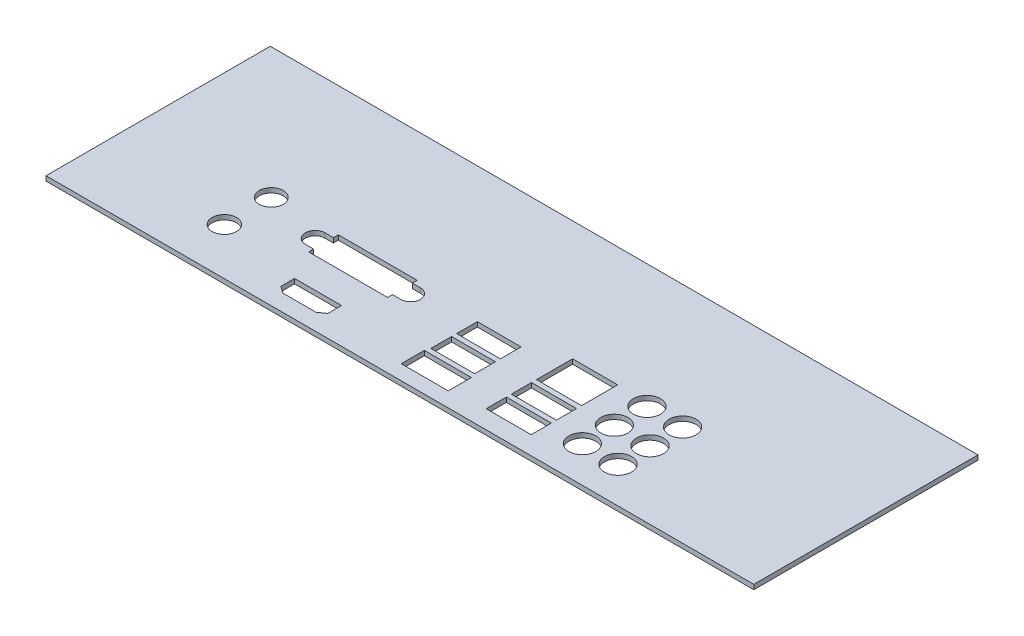
from build123d import *

# Parameters (mm, degrees)
SKETCH1_W           = 239.388843642
SKETCH1_H           = 75.842411424
BOSS_EXTRUDE1_DEPTH = 1.5875
CUT_EXTRUDE1_REACH  = 127.568
SKETCH2_R           = 4.1275
SKETCH2_R_2         = 4.572
SKETCH2_R_3         = 4.0513
SKETCH2_W           = 14.8082
SKETCH2_H           = 7.0104
SKETCH2_W_2         = 15.9004
SKETCH2_H_2         = 7.8232
SKETCH2_W_3         = 15.24
SKETCH2_H_3         = 12.2174
SKETCH2_H_4         = 6.8072


with BuildPart() as part:
    # Sketch1 → Boss-Extrude1 (new body)
    with BuildSketch(Plane(origin=(0, 0, 0), x_dir=(1, 0, 0), z_dir=(0, 1, 0))):
        Rectangle(SKETCH1_W, SKETCH1_H)
    extrude(amount=-BOSS_EXTRUDE1_DEPTH)

    # Sketch2 → Cut-Extrude1 (cut, up to next)
    with BuildSketch(Plane(origin=(0, 0, 0), x_dir=(1, 0, 0), z_dir=(0, 1, 0)), mode=Mode.PRIVATE) as cut_extrude1_sk1:
        with Locations(Location((-75.244421821, -22.046205712, 0), (0, 0, 270))):
            Circle(SKETCH2_R)
    cut_extrude1_tool1 = extrude(cut_extrude1_sk1.sketch, amount=-CUT_EXTRUDE1_REACH, mode=Mode.PRIVATE) & part.part
    # Sketch2 → Cut-Extrude1 (cut, up to next)
    with BuildSketch(Plane(origin=(0, 0, 0), x_dir=(1, 0, 0), z_dir=(0, 1, 0)), mode=Mode.PRIVATE) as cut_extrude1_sk2:
        with Locations(Location((49.507678179, -25.713445712, 0), (0, 0, 270))):
            Circle(SKETCH2_R_2)
    cut_extrude1_tool2 = extrude(cut_extrude1_sk2.sketch, amount=-CUT_EXTRUDE1_REACH, mode=Mode.PRIVATE) & part.part
    # Sketch2 → Cut-Extrude1 (cut, up to next)
    with BuildSketch(Plane(origin=(0, 0, 0), x_dir=(1, 0, 0), z_dir=(0, 1, 0)), mode=Mode.PRIVATE) as cut_extrude1_sk3:
        with Locations(Location((-75.244421821, -6.171205712, 0), (0, 0, 270))):
            Circle(SKETCH2_R_3)
    cut_extrude1_tool3 = extrude(cut_extrude1_sk3.sketch, amount=-CUT_EXTRUDE1_REACH, mode=Mode.PRIVATE) & part.part
    # Sketch2 → Cut-Extrude1 (cut, up to next)
    with BuildSketch(Plane(origin=(0, 0, 0), x_dir=(1, 0, 0), z_dir=(0, 1, 0)), mode=Mode.PRIVATE) as cut_extrude1_sk4:
        with Locations(Location((49.507678179, -3.869445712, 0), (0, 0, 270))):
            Circle(SKETCH2_R_2)
    cut_extrude1_tool4 = extrude(cut_extrude1_sk4.sketch, amount=-CUT_EXTRUDE1_REACH, mode=Mode.PRIVATE) & part.part
    # Sketch2 → Cut-Extrude1 (cut, up to next)
    with BuildSketch(Plane(origin=(0, 0, 0), x_dir=(1, 0, 0), z_dir=(0, 1, 0)), mode=Mode.PRIVATE) as cut_extrude1_sk5:
        with Locations(Location((61.572678179, -3.869445712, 0), (0, 0, 270))):
            Circle(SKETCH2_R_2)
    cut_extrude1_tool5 = extrude(cut_extrude1_sk5.sketch, amount=-CUT_EXTRUDE1_REACH, mode=Mode.PRIVATE) & part.part
    # Sketch2 → Cut-Extrude1 (cut, up to next)
    with BuildSketch(Plane(origin=(0, 0, 0), x_dir=(1, 0, 0), z_dir=(0, 1, 0)), mode=Mode.PRIVATE) as cut_extrude1_sk6:
        with Locations(Location((49.507678179, -14.893045712, 0), (0, 0, 270))):
            Circle(SKETCH2_R_2)
    cut_extrude1_tool6 = extrude(cut_extrude1_sk6.sketch, amount=-CUT_EXTRUDE1_REACH, mode=Mode.PRIVATE) & part.part
    # Sketch2 → Cut-Extrude1 (cut, up to next)
    with BuildSketch(Plane(origin=(0, 0, 0), x_dir=(1, 0, 0), z_dir=(0, 1, 0)), mode=Mode.PRIVATE) as cut_extrude1_sk7:
        with Locations(Location((61.572678179, -14.893045712, 0), (0, 0, 270))):
            Circle(SKETCH2_R_2)
    cut_extrude1_tool7 = extrude(cut_extrude1_sk7.sketch, amount=-CUT_EXTRUDE1_REACH, mode=Mode.PRIVATE) & part.part
    # Sketch2 → Cut-Extrude1 (cut, up to next)
    with BuildSketch(Plane(origin=(0, 0, 0), x_dir=(1, 0, 0), z_dir=(0, 1, 0)), mode=Mode.PRIVATE) as cut_extrude1_sk8:
        with Locations(Location((61.572678179, -25.713445712, 0), (0, 0, 270))):
            Circle(SKETCH2_R_2)
    cut_extrude1_tool8 = extrude(cut_extrude1_sk8.sketch, amount=-CUT_EXTRUDE1_REACH, mode=Mode.PRIVATE) & part.part
    # Sketch2 → Cut-Extrude1 (cut, up to next)
    with BuildSketch(Plane(origin=(0, 0, 0), x_dir=(1, 0, 0), z_dir=(0, 1, 0)), mode=Mode.PRIVATE) as cut_extrude1_sk9:
        Polygon((-47.558421821, -25.977996251), (-31.683421821, -25.977996251), (-31.683421821, -30.60665864), (-34.032921821, -32.251796251), (-45.208921821, -32.251796251), (-47.558421821, -30.60665864), align=None)
    cut_extrude1_tool9 = extrude(cut_extrude1_sk9.sketch, amount=-CUT_EXTRUDE1_REACH, mode=Mode.PRIVATE) & part.part
    # Sketch2 → Cut-Extrude1 (cut, up to next)
    with BuildSketch(Plane(origin=(0, 0, 0), x_dir=(1, 0, 0), z_dir=(0, 1, 0)), mode=Mode.PRIVATE) as cut_extrude1_sk10:
        with BuildLine():
            Line((-52.955921821, -14.154296251), (-52.955921821, -15.817996251))
            Line((-52.955921821, -15.817996251), (-26.285921821, -15.817996251))
            Line((-26.285921821, -15.817996251), (-26.285921821, -14.154296251))
            Line((-26.285921821, -14.154296251), (-23.479221821, -14.154296251))
            ThreePointArc((-23.479221821, -14.154296251), (-20.126421821, -10.801496251), (-23.479221821, -7.448696251))
            Line((-23.479221821, -7.448696251), (-26.285921821, -7.448696251))
            Line((-26.285921821, -7.448696251), (-26.285921821, -5.784996251))
            Line((-26.285921821, -5.784996251), (-52.955921821, -5.784996251))
            Line((-52.955921821, -5.784996251), (-52.955921821, -7.448696251))
            Line((-52.955921821, -7.448696251), (-55.762621821, -7.448696251))
            ThreePointArc((-55.762621821, -7.448696251), (-59.115421821, -10.801496251), (-55.762621821, -14.154296251))
            Line((-55.762621821, -14.154296251), (-52.955921821, -14.154296251))
        make_face()
    cut_extrude1_tool10 = extrude(cut_extrude1_sk10.sketch, amount=-CUT_EXTRUDE1_REACH, mode=Mode.PRIVATE) & part.part
    # Sketch2 → Cut-Extrude1 (cut, up to next)
    with BuildSketch(Plane(origin=(0, 0, 0), x_dir=(1, 0, 0), z_dir=(0, 1, 0)), mode=Mode.PRIVATE) as cut_extrude1_sk11:
        with Locations((3.401875226, -11.222745712)):
            Rectangle(SKETCH2_W, SKETCH2_H)
    cut_extrude1_tool11 = extrude(cut_extrude1_sk11.sketch, amount=-CUT_EXTRUDE1_REACH, mode=Mode.PRIVATE) & part.part
    # Sketch2 → Cut-Extrude1 (cut, up to next)
    with BuildSketch(Plane(origin=(0, 0, 0), x_dir=(1, 0, 0), z_dir=(0, 1, 0)), mode=Mode.PRIVATE) as cut_extrude1_sk12:
        with Locations((3.401875226, -19.934945712)):
            Rectangle(SKETCH2_W, SKETCH2_H)
    cut_extrude1_tool12 = extrude(cut_extrude1_sk12.sketch, amount=-CUT_EXTRUDE1_REACH, mode=Mode.PRIVATE) & part.part
    # Sketch2 → Cut-Extrude1 (cut, up to next)
    with BuildSketch(Plane(origin=(0, 0, 0), x_dir=(1, 0, 0), z_dir=(0, 1, 0)), mode=Mode.PRIVATE) as cut_extrude1_sk13:
        with Locations((3.401875226, -29.002745712)):
            Rectangle(SKETCH2_W_2, SKETCH2_H_2)
    cut_extrude1_tool13 = extrude(cut_extrude1_sk13.sketch, amount=-CUT_EXTRUDE1_REACH, mode=Mode.PRIVATE) & part.part
    # Sketch2 → Cut-Extrude1 (cut, up to next)
    with BuildSketch(Plane(origin=(0, 0, 0), x_dir=(1, 0, 0), z_dir=(0, 1, 0)), mode=Mode.PRIVATE) as cut_extrude1_sk14:
        with Locations((30.610078179, -8.596905712)):
            Rectangle(SKETCH2_W_3, SKETCH2_H_3)
    cut_extrude1_tool14 = extrude(cut_extrude1_sk14.sketch, amount=-CUT_EXTRUDE1_REACH, mode=Mode.PRIVATE) & part.part
    # Sketch2 → Cut-Extrude1 (cut, up to next)
    with BuildSketch(Plane(origin=(0, 0, 0), x_dir=(1, 0, 0), z_dir=(0, 1, 0)), mode=Mode.PRIVATE) as cut_extrude1_sk15:
        with Locations((30.610078179, -19.811005712)):
            Rectangle(SKETCH2_W_3, SKETCH2_H_4)
    cut_extrude1_tool15 = extrude(cut_extrude1_sk15.sketch, amount=-CUT_EXTRUDE1_REACH, mode=Mode.PRIVATE) & part.part
    # Sketch2 → Cut-Extrude1 (cut, up to next)
    with BuildSketch(Plane(origin=(0, 0, 0), x_dir=(1, 0, 0), z_dir=(0, 1, 0)), mode=Mode.PRIVATE) as cut_extrude1_sk16:
        with Locations((30.610078179, -28.320005712)):
            Rectangle(SKETCH2_W_3, SKETCH2_H_4)
    cut_extrude1_tool16 = extrude(cut_extrude1_sk16.sketch, amount=-CUT_EXTRUDE1_REACH, mode=Mode.PRIVATE) & part.part
    add(cut_extrude1_tool1.solids().sort_by_distance((-75.244422, 0, 22.046206))[0], mode=Mode.SUBTRACT)
    add(cut_extrude1_tool2.solids().sort_by_distance((49.507678, 0, 25.713446))[0], mode=Mode.SUBTRACT)
    add(cut_extrude1_tool3.solids().sort_by_distance((-75.244422, 0, 6.171206))[0], mode=Mode.SUBTRACT)
    add(cut_extrude1_tool4.solids().sort_by_distance((49.507678, 0, 3.869446))[0], mode=Mode.SUBTRACT)
    add(cut_extrude1_tool5.solids().sort_by_distance((61.572678, 0, 3.869446))[0], mode=Mode.SUBTRACT)
    add(cut_extrude1_tool6.solids().sort_by_distance((49.507678, 0, 14.893046))[0], mode=Mode.SUBTRACT)
    add(cut_extrude1_tool7.solids().sort_by_distance((61.572678, 0, 14.893046))[0], mode=Mode.SUBTRACT)
    add(cut_extrude1_tool8.solids().sort_by_distance((61.572678, 0, 25.713446))[0], mode=Mode.SUBTRACT)
    add(cut_extrude1_tool9.solids().sort_by_distance((-39.620922, 0, 29.010382))[0], mode=Mode.SUBTRACT)
    add(cut_extrude1_tool10.solids().sort_by_distance((-39.620922, 0, 10.801496))[0], mode=Mode.SUBTRACT)
    add(cut_extrude1_tool11.solids().sort_by_distance((3.401875, 0, 11.222746))[0], mode=Mode.SUBTRACT)
    add(cut_extrude1_tool12.solids().sort_by_distance((3.401875, 0, 19.934946))[0], mode=Mode.SUBTRACT)
    add(cut_extrude1_tool13.solids().sort_by_distance((3.401875, 0, 29.002746))[0], mode=Mode.SUBTRACT)
    add(cut_extrude1_tool14.solids().sort_by_distance((30.610078, 0, 8.596906))[0], mode=Mode.SUBTRACT)
    add(cut_extrude1_tool15.solids().sort_by_distance((30.610078, 0, 19.811006))[0], mode=Mode.SUBTRACT)
    add(cut_extrude1_tool16.solids().sort_by_distance((30.610078, 0, 28.320006))[0], mode=Mode.SUBTRACT)


solid = part.part
